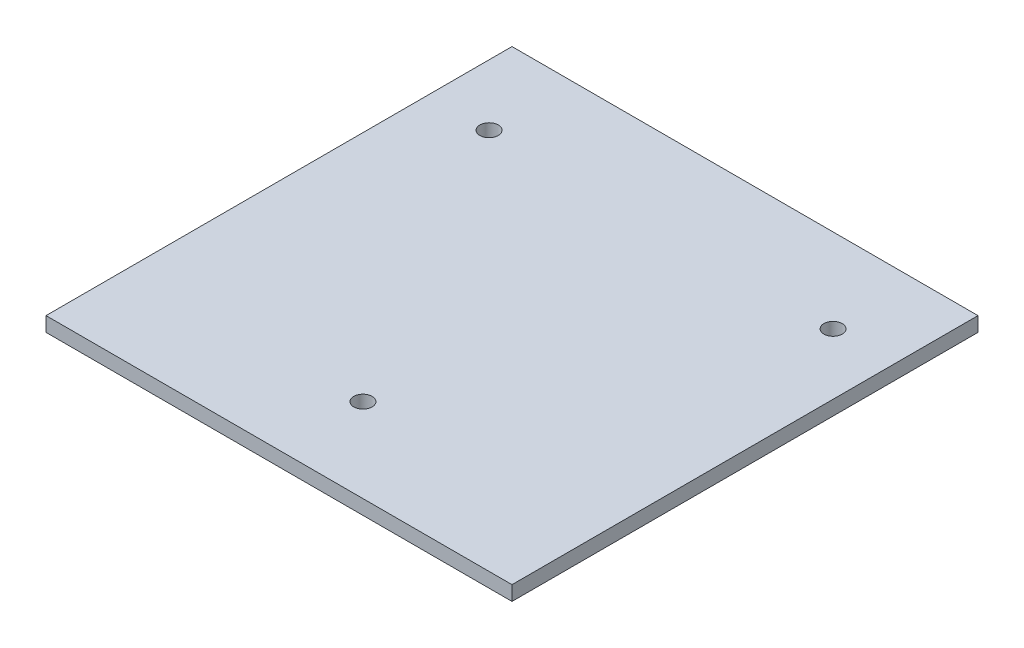
from build123d import *

# Parameters (mm, degrees)
ESQUISSE1_W             = 203.2
ESQUISSE1_H             = 203.2
BOSS_EXTRU_1_DEPTH      = 6.35
ESQUISSE2_R             = 4
ENL_V_MAT_EXTRU_1_DEPTH = 144.824345992


with BuildPart() as part:
    # Esquisse1 → Boss.-Extru.1 (new body)
    with BuildSketch(Plane(origin=(0, 0, 0), x_dir=(1, 0, 0), z_dir=(0, 1, 0))):
        Rectangle(ESQUISSE1_W, ESQUISSE1_H)
    extrude(amount=BOSS_EXTRU_1_DEPTH)

    # Esquisse2 → Enlèv. mat.-Extru.1 (cut, through all)
    with BuildSketch(Plane(origin=(0, 6.35, 0), x_dir=(1, 0, 0), z_dir=(0, 1, 0))):
        with Locations(Location((-75, 65, 0), (0, 0, 270))):
            Circle(ESQUISSE2_R)
        with Locations(Location((75, 65, 0), (0, 0, 270))):
            Circle(ESQUISSE2_R)
        with Locations(Location((0, -65, 0), (0, 0, 270))):
            Circle(ESQUISSE2_R)
    extrude(amount=-ENL_V_MAT_EXTRU_1_DEPTH, mode=Mode.SUBTRACT)


solid = part.part
